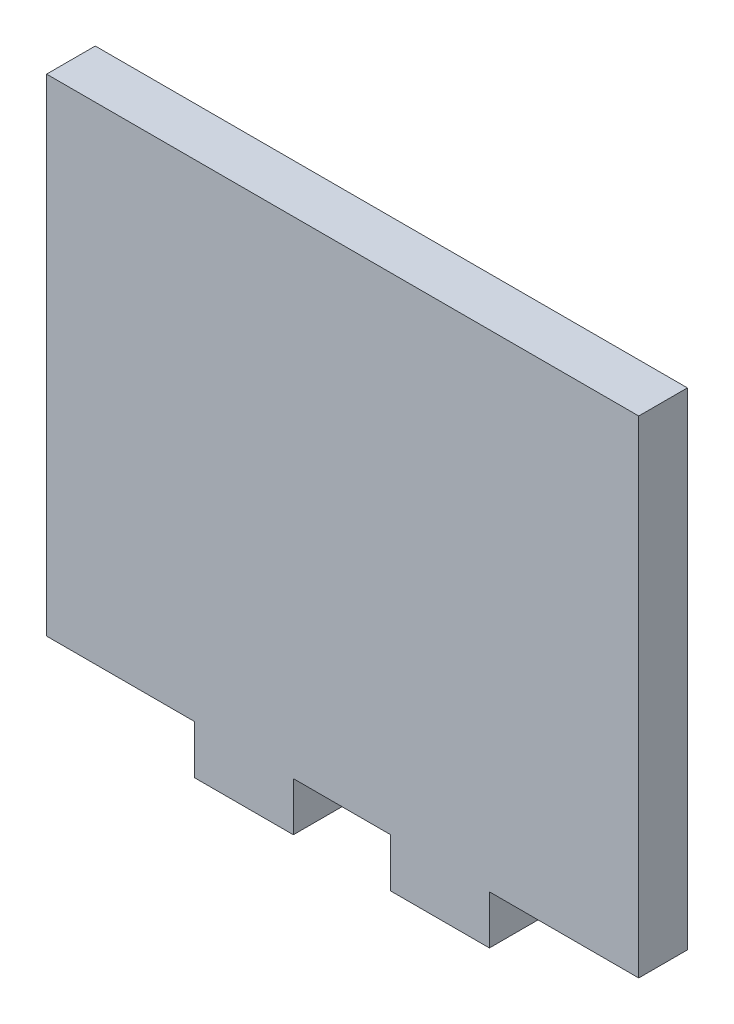
from build123d import *

# Parameters (mm, degrees)
BOSS_EXTRU_1_DEPTH = 5


with BuildPart() as part:
    # Esquisse1 → Boss.-Extru.1 (new body)
    with BuildSketch(Plane.XY):
        Polygon((-13.06444963, 0), (2.14555037, 0), (2.14555037, -5), (12.28555037, -5), (12.28555037, 0), (22.28555037, 0), (22.28555037, -5), (32.42555037, -5), (32.42555037, 0), (47.76555037, 0), (47.76555037, 50), (-13.06444963, 50), align=None)
    extrude(amount=BOSS_EXTRU_1_DEPTH)


solid = part.part
